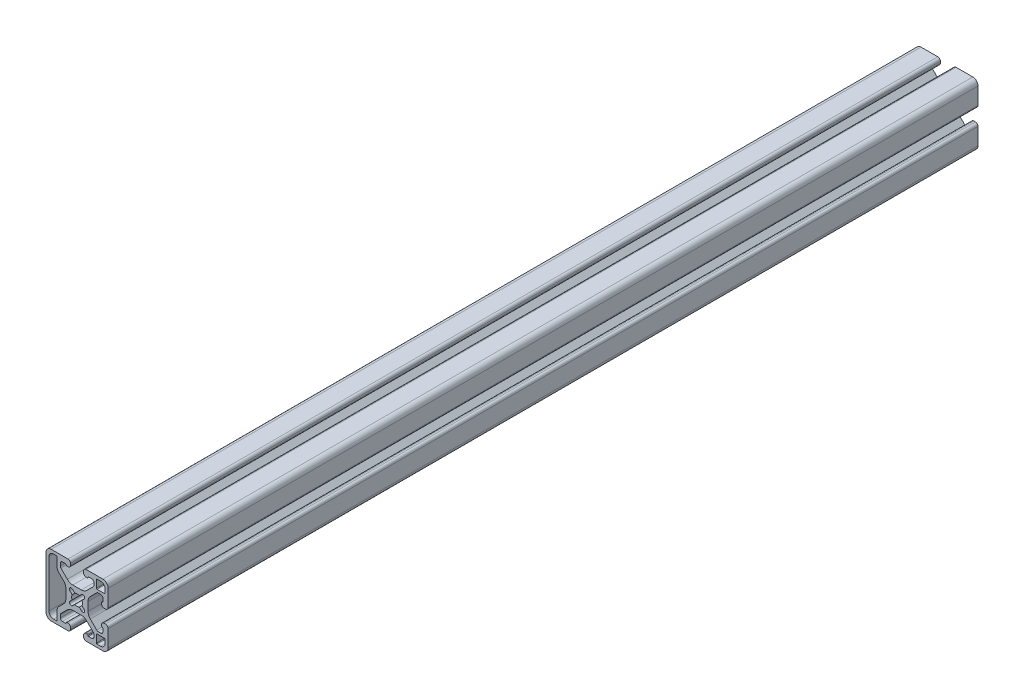
from build123d import *

# Parameters (mm, degrees)
BOSS_EXTRUDE1_DEPTH = 533.4


with BuildPart() as part:
    # Sketch1 → Boss-Extrude1 (new body)
    with BuildSketch(Plane(origin=(0, 0, -533.4), x_dir=(-1, 0, 0), z_dir=(0, 0, -1))):
        with BuildLine():
            Line((19.05, -15.875), (19.05, 15.875))
            ThreePointArc((19.05, 15.875), (18.12006403, 18.12006403), (15.875, 19.05))
            Line((15.875, 19.05), (5.579502658, 19.05))
            ThreePointArc((5.579502658, 19.05), (4.485554656, 18.608016318), (4.005661984, 17.530159727))
            Line((4.005661984, 17.530159727), (3.973730432, 16.615759727))
            ThreePointArc((3.973730432, 16.615759727), (4.414754789, 15.466851998), (5.547571106, 14.986))
            Line((5.547571106, 14.986), (6.268347165, 14.986))
            ThreePointArc((6.268347165, 14.986), (6.533012004, 15.092931536), (6.64911507, 15.353703292))
            Line((6.64911507, 15.353703292), (6.652704695, 15.456496708))
            ThreePointArc((6.652704695, 15.456496708), (6.768807761, 15.717268464), (7.0334726, 15.8242))
            Line((7.0334726, 15.8242), (9.017, 15.8242))
            ThreePointArc((9.017, 15.8242), (9.915025612, 15.452225612), (10.287, 14.5542))
            Line((10.287, 14.5542), (10.287, 12.968317424))
            ThreePointArc((10.287, 12.968317424), (10.190327006, 12.482309465), (9.915025612, 12.070291812))
            Line((9.915025612, 12.070291812), (5.966918011, 8.122184211))
            ThreePointArc((5.966918011, 8.122184211), (4.425971988, 7.092556996), (2.608302221, 6.731))
            Line((2.608302221, 6.731), (-2.608302221, 6.731))
            ThreePointArc((-2.608302221, 6.731), (-4.425971988, 7.092556996), (-5.966918011, 8.122184211))
            Line((-5.966918011, 8.122184211), (-9.915025612, 12.070291812))
            ThreePointArc((-9.915025612, 12.070291812), (-10.190327006, 12.482309465), (-10.287, 12.968317424))
            Line((-10.287, 12.968317424), (-10.287, 14.5542))
            ThreePointArc((-10.287, 14.5542), (-9.915025612, 15.452225612), (-9.017, 15.8242))
            Line((-9.017, 15.8242), (-7.0334726, 15.8242))
            ThreePointArc((-7.0334726, 15.8242), (-6.768807761, 15.717268464), (-6.652704695, 15.456496708))
            Line((-6.652704695, 15.456496708), (-6.64911507, 15.353703292))
            ThreePointArc((-6.64911507, 15.353703292), (-6.533012004, 15.092931536), (-6.268347165, 14.986))
            Line((-6.268347165, 14.986), (-5.547571106, 14.986))
            ThreePointArc((-5.547571106, 14.986), (-4.414754789, 15.466851998), (-3.973730432, 16.615759727))
            Line((-3.973730432, 16.615759727), (-4.005661984, 17.530159727))
            ThreePointArc((-4.005661984, 17.530159727), (-4.485554656, 18.608016318), (-5.579502658, 19.05))
            Line((-5.579502658, 19.05), (-15.875, 19.05))
            ThreePointArc((-15.875, 19.05), (-18.12006403, 18.12006403), (-19.05, 15.875))
            Line((-19.05, 15.875), (-19.05, 5.579502658))
            ThreePointArc((-19.05, 5.579502658), (-18.608016318, 4.485554656), (-17.530159727, 4.005661984))
            Line((-17.530159727, 4.005661984), (-16.615759727, 3.973730432))
            ThreePointArc((-16.615759727, 3.973730432), (-15.466851998, 4.414754789), (-14.986, 5.547571106))
            Line((-14.986, 5.547571106), (-14.986, 6.268347165))
            ThreePointArc((-14.986, 6.268347165), (-15.092931536, 6.533012004), (-15.353703292, 6.64911507))
            Line((-15.353703292, 6.64911507), (-15.456496708, 6.652704695))
            ThreePointArc((-15.456496708, 6.652704695), (-15.717268464, 6.768807761), (-15.8242, 7.0334726))
            Line((-15.8242, 7.0334726), (-15.8242, 9.017))
            ThreePointArc((-15.8242, 9.017), (-15.452225612, 9.915025612), (-14.5542, 10.287))
            Line((-14.5542, 10.287), (-12.968317424, 10.287))
            ThreePointArc((-12.968317424, 10.287), (-12.482309465, 10.190327006), (-12.070291812, 9.915025612))
            Line((-12.070291812, 9.915025612), (-8.122184211, 5.966918011))
            ThreePointArc((-8.122184211, 5.966918011), (-7.092556996, 4.425971988), (-6.731, 2.608302221))
            Line((-6.731, 2.608302221), (-6.731, -2.608302221))
            ThreePointArc((-6.731, -2.608302221), (-7.092556996, -4.425971988), (-8.122184211, -5.966918011))
            Line((-8.122184211, -5.966918011), (-12.070291812, -9.915025612))
            ThreePointArc((-12.070291812, -9.915025612), (-12.482309465, -10.190327006), (-12.968317424, -10.287))
            Line((-12.968317424, -10.287), (-14.5542, -10.287))
            ThreePointArc((-14.5542, -10.287), (-15.452225612, -9.915025612), (-15.8242, -9.017))
            Line((-15.8242, -9.017), (-15.8242, -7.0334726))
            ThreePointArc((-15.8242, -7.0334726), (-15.717268464, -6.768807761), (-15.456496708, -6.652704695))
            Line((-15.456496708, -6.652704695), (-15.353703292, -6.64911507))
            ThreePointArc((-15.353703292, -6.64911507), (-15.092931536, -6.533012004), (-14.986, -6.268347165))
            Line((-14.986, -6.268347165), (-14.986, -5.547571106))
            ThreePointArc((-14.986, -5.547571106), (-15.466851998, -4.414754789), (-16.615759727, -3.973730432))
            Line((-16.615759727, -3.973730432), (-17.530159727, -4.005661984))
            ThreePointArc((-17.530159727, -4.005661984), (-18.608016318, -4.485554656), (-19.05, -5.579502658))
            Line((-19.05, -5.579502658), (-19.05, -15.875))
            ThreePointArc((-19.05, -15.875), (-18.12006403, -18.12006403), (-15.875, -19.05))
            Line((-15.875, -19.05), (-5.579502658, -19.05))
            ThreePointArc((-5.579502658, -19.05), (-4.485554656, -18.608016318), (-4.005661984, -17.530159727))
            Line((-4.005661984, -17.530159727), (-3.973730432, -16.615759727))
            ThreePointArc((-3.973730432, -16.615759727), (-4.414754789, -15.466851998), (-5.547571106, -14.986))
            Line((-5.547571106, -14.986), (-6.268347165, -14.986))
            ThreePointArc((-6.268347165, -14.986), (-6.533012004, -15.092931536), (-6.64911507, -15.353703292))
            Line((-6.64911507, -15.353703292), (-6.652704695, -15.456496708))
            ThreePointArc((-6.652704695, -15.456496708), (-6.768807761, -15.717268464), (-7.0334726, -15.8242))
            Line((-7.0334726, -15.8242), (-9.017, -15.8242))
            ThreePointArc((-9.017, -15.8242), (-9.915025612, -15.452225612), (-10.287, -14.5542))
            Line((-10.287, -14.5542), (-10.287, -12.968317424))
            ThreePointArc((-10.287, -12.968317424), (-10.190327006, -12.482309465), (-9.915025612, -12.070291812))
            Line((-9.915025612, -12.070291812), (-5.966918011, -8.122184211))
            ThreePointArc((-5.966918011, -8.122184211), (-4.425971988, -7.092556996), (-2.608302221, -6.731))
            Line((-2.608302221, -6.731), (2.608302221, -6.731))
            ThreePointArc((2.608302221, -6.731), (4.425971988, -7.092556996), (5.966918011, -8.122184211))
            Line((5.966918011, -8.122184211), (9.915025612, -12.070291812))
            ThreePointArc((9.915025612, -12.070291812), (10.190327006, -12.482309465), (10.287, -12.968317424))
            Line((10.287, -12.968317424), (10.287, -14.5542))
            ThreePointArc((10.287, -14.5542), (9.915025612, -15.452225612), (9.017, -15.8242))
            Line((9.017, -15.8242), (7.0334726, -15.8242))
            ThreePointArc((7.0334726, -15.8242), (6.768807761, -15.717268464), (6.652704695, -15.456496708))
            Line((6.652704695, -15.456496708), (6.64911507, -15.353703292))
            ThreePointArc((6.64911507, -15.353703292), (6.533012004, -15.092931536), (6.268347165, -14.986))
            Line((6.268347165, -14.986), (5.547571106, -14.986))
            ThreePointArc((5.547571106, -14.986), (4.414754789, -15.466851998), (3.973730432, -16.615759727))
            Line((3.973730432, -16.615759727), (4.005661984, -17.530159727))
            ThreePointArc((4.005661984, -17.530159727), (4.485554656, -18.608016318), (5.579502658, -19.05))
            Line((5.579502658, -19.05), (15.875, -19.05))
            ThreePointArc((15.875, -19.05), (18.12006403, -18.12006403), (19.05, -15.875))
        make_face()
        with BuildLine():
            Line((17.246274531, 14.452274531), (17.246274531, -14.452265069))
            ThreePointArc((17.246274531, -14.452265069), (16.427930878, -16.427921416), (14.452274531, -17.246265069))
            Line((14.452274531, -17.246265069), (12.580319931, -17.246265069))
            ThreePointArc((12.580319931, -17.246265069), (12.310912247, -17.134672753), (12.199319931, -16.865265069))
            Line((12.199319931, -16.865265069), (12.199319931, -11.359181791))
            ThreePointArc((12.199319931, -11.359181791), (11.957637447, -10.144161894), (11.269383961, -9.114117761))
            Line((11.269383961, -9.114117761), (8.256910542, -6.101644342))
            ThreePointArc((8.256910542, -6.101644342), (7.227283327, -4.560698319), (6.865726331, -2.743028552))
            Line((6.865726331, -2.743028552), (6.865726331, 2.743028552))
            ThreePointArc((6.865726331, 2.743028552), (7.227283327, 4.560698319), (8.256910542, 6.101644342))
            Line((8.256910542, 6.101644342), (11.269383961, 9.114117761))
            ThreePointArc((11.269383961, 9.114117761), (11.957637447, 10.144161894), (12.199319931, 11.359181791))
            Line((12.199319931, 11.359181791), (12.199319931, 16.865274531))
            ThreePointArc((12.199319931, 16.865274531), (12.310912247, 17.134682215), (12.580319931, 17.246274531))
            Line((12.580319931, 17.246274531), (14.452274531, 17.246274531))
            ThreePointArc((14.452274531, 17.246274531), (16.427930878, 16.427930878), (17.246274531, 14.452274531))
        make_face(mode=Mode.SUBTRACT)
        with BuildLine():
            Line((3.017877069, -1.401430967), (4.343300944, -2.726854842))
            ThreePointArc((4.343300944, -2.726854842), (4.343300944, -4.343300944), (2.726854842, -4.343300944))
            Line((2.726854842, -4.343300944), (1.401430967, -3.017877069))
            ThreePointArc((1.401430967, -3.017877069), (0, -3.3274), (-1.401430967, -3.017877069))
            Line((-1.401430967, -3.017877069), (-2.726854842, -4.343300944))
            ThreePointArc((-2.726854842, -4.343300944), (-4.343300944, -4.343300944), (-4.343300944, -2.726854842))
            Line((-4.343300944, -2.726854842), (-3.017877069, -1.401430967))
            ThreePointArc((-3.017877069, -1.401430967), (-3.3274, 0), (-3.017877069, 1.401430967))
            Line((-3.017877069, 1.401430967), (-4.343300944, 2.726854842))
            ThreePointArc((-4.343300944, 2.726854842), (-4.343300944, 4.343300944), (-2.726854842, 4.343300944))
            Line((-2.726854842, 4.343300944), (-1.401430967, 3.017877069))
            ThreePointArc((-1.401430967, 3.017877069), (0, 3.3274), (1.401430967, 3.017877069))
            Line((1.401430967, 3.017877069), (2.726854842, 4.343300944))
            ThreePointArc((2.726854842, 4.343300944), (4.343300944, 4.343300944), (4.343300944, 2.726854842))
            Line((4.343300944, 2.726854842), (3.017877069, 1.401430967))
            ThreePointArc((3.017877069, 1.401430967), (3.3274, 0), (3.017877069, -1.401430967))
        make_face(mode=Mode.SUBTRACT)
        with BuildLine():
            Line((-11.8618, 16.8656), (-11.8618, 12.2428))
            ThreePointArc((-11.8618, 12.2428), (-11.973392316, 11.973392316), (-12.2428, 11.8618))
            Line((-12.2428, 11.8618), (-16.8656, 11.8618))
            ThreePointArc((-16.8656, 11.8618), (-17.135007684, 11.973392316), (-17.2466, 12.2428))
            Line((-17.2466, 12.2428), (-17.2466, 14.4526))
            ThreePointArc((-17.2466, 14.4526), (-16.428256347, 16.428256347), (-14.4526, 17.2466))
            Line((-14.4526, 17.2466), (-12.2428, 17.2466))
            ThreePointArc((-12.2428, 17.2466), (-11.973392316, 17.135007684), (-11.8618, 16.8656))
        make_face(mode=Mode.SUBTRACT)
        with BuildLine():
            Line((-11.8618, -12.2428), (-11.8618, -16.8656))
            ThreePointArc((-11.8618, -16.8656), (-11.973392316, -17.135007684), (-12.2428, -17.2466))
            Line((-12.2428, -17.2466), (-14.4526, -17.2466))
            ThreePointArc((-14.4526, -17.2466), (-16.428256347, -16.428256347), (-17.2466, -14.4526))
            Line((-17.2466, -14.4526), (-17.2466, -12.2428))
            ThreePointArc((-17.2466, -12.2428), (-17.135007684, -11.973392316), (-16.8656, -11.8618))
            Line((-16.8656, -11.8618), (-12.2428, -11.8618))
            ThreePointArc((-12.2428, -11.8618), (-11.973392316, -11.973392316), (-11.8618, -12.2428))
        make_face(mode=Mode.SUBTRACT)
    extrude(amount=-BOSS_EXTRUDE1_DEPTH)


solid = part.part
